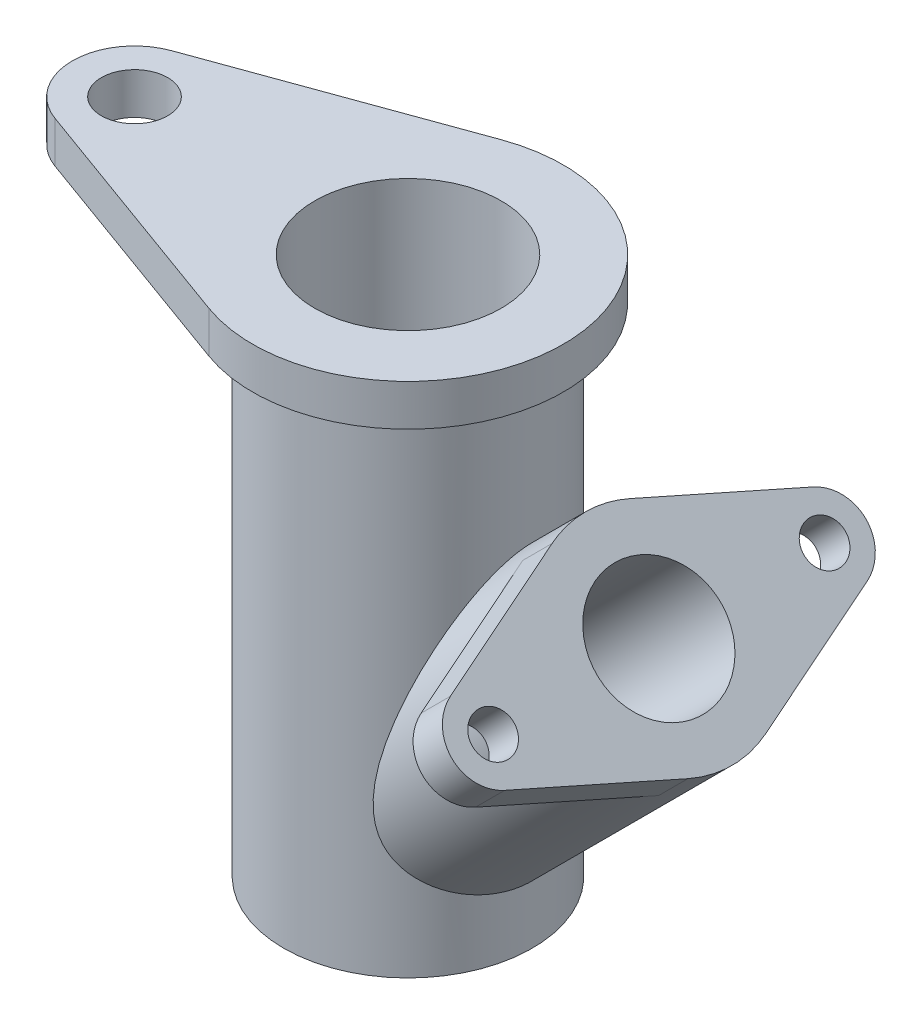
from build123d import *
from build123d.topology import SkipClean

# Parameters (mm, degrees)
SKETCH_1_R                      = 60
EXTRUDE_1_DEPTH                 = 240
SKETCH_2_R                      = 16
EXTRUDE_2_DEPTH                 = 20
CUT_EXTRUDE_1_DEPTH             = 316.38706378
CUT_EXTRUDE_1_DEPTH_BACK        = 316.38706378
SKETCH_6_R                      = 45
EXTRUDE_3_REACH                 = 335.721
EXTRUDE_3_END_RADIUS            = 60
SKETCH_5_R                      = 50
SKETCH_5_R_2                    = 30
CUT_EXTRUDE_2_REACH             = 343.929
SKETCH_8_R                      = 30
CUT_EXTRUDE_2_DIRECTION_2_DEPTH = 342.928852652
SKETCH_9_R                      = 10
SKETCH_9_R_2                    = 30
EXTRUDE_4_DEPTH                 = 20


with BuildPart() as part:
    # 草图1 → 凸台-拉伸1 (new body)
    with BuildSketch(Plane(origin=(0, 0, 0), x_dir=(1, 0, 0), z_dir=(0, 1, 0))):
        with Locations(Location((0, 0, 0), (0, 0, 270))):
            Circle(SKETCH_1_R)
    extrude(amount=EXTRUDE_1_DEPTH)

    # 草图2 → 凸台-拉伸2 (add)
    with BuildSketch(Plane(origin=(0, 240, 0), x_dir=(1, 0, 0), z_dir=(0, 1, 0))):
        with BuildLine():
            Line((-142.227272727, 28.202888018), (-25.568181818, 70.507220045))
            ThreePointArc((-25.568181818, 70.507220045), (75, 0), (-25.568181818, -70.507220045))
            Line((-25.568181818, -70.507220045), (-142.227272727, -28.202888018))
            ThreePointArc((-142.227272727, -28.202888018), (-162, 0), (-142.227272727, 28.202888018))
        make_face()
        with Locations(Location((-132, 0, 0), (0, 0, 270))):
            Circle(SKETCH_2_R, mode=Mode.SUBTRACT)
    extrude(amount=EXTRUDE_2_DEPTH)

    # 草图6 → 切除-拉伸1 (cut, two sides: drawn at the far end of the back side and taken through both)
    with BuildSketch(Plane(origin=(0, 260, 0), x_dir=(1, 0, 0), z_dir=(0, 1, 0)).offset(-CUT_EXTRUDE_1_DEPTH_BACK)):
        with Locations(Location((0, 0, 0), (0, 0, 270))):
            Circle(SKETCH_6_R)
    extrude(amount=CUT_EXTRUDE_1_DEPTH + CUT_EXTRUDE_1_DEPTH_BACK, mode=Mode.SUBTRACT)

    # 凸台-拉伸3: up to this cylinder (the profile starts outside it)
    extrude_3_end = Plane(origin=(0, 125.644661, 0), z_dir=(0, -1, 0)) * Cylinder(EXTRUDE_3_END_RADIUS, 792.442, mode=Mode.PRIVATE)
    # 草图5 → 凸台-拉伸3 (add, up to the surface)
    with BuildSketch(Plane(origin=(121.098951134, 160, 0), x_dir=(0.7071067811865488, -0.7071067811865464, 0), z_dir=(0.7071067811865464, 0.7071067811865488, 0)), mode=Mode.PRIVATE) as extrude_3_sk1:
        with Locations(Location((0, 0, 0), (0, 0, 180))):
            Circle(SKETCH_5_R)
        with Locations(Location((0, 0, 0), (0, 0, 180))):
            Circle(SKETCH_5_R_2, mode=Mode.SUBTRACT)
    extrude_3_tool1 = extrude(extrude_3_sk1.sketch, amount=-EXTRUDE_3_REACH, mode=Mode.PRIVATE) - extrude_3_end
    add(extrude_3_tool1.solids().sort_by_distance((155.45429, 125.644661, 0))[0])

    # 草图8 → 切除-拉伸2 (cut, up to next)
    with BuildSketch(Plane(origin=(140.549475567, 140.549475567, 0), x_dir=(0, 0, -1), z_dir=(0.7071067811865465, 0.7071067811865487, 0)), mode=Mode.PRIVATE) as cut_extrude_2_sk1:
        with Locations(Location((0, 27.507195448, 0), (0, 0, 90))):
            Circle(SKETCH_8_R)
    cut_extrude_2_tool1 = extrude(cut_extrude_2_sk1.sketch, amount=-CUT_EXTRUDE_2_REACH, mode=Mode.PRIVATE) & part.part
    add(cut_extrude_2_tool1.solids().sort_by_distance((121.098951, 160, 0))[0], mode=Mode.SUBTRACT)

    # 草图8 → 切除-拉伸2 direction 2 (cut)
    with BuildSketch(Plane(origin=(140.549475567, 140.549475567, 0), x_dir=(0, 0, -1), z_dir=(0.7071067811865465, 0.7071067811865487, 0))):
        with Locations(Location((0, 27.507195448, 0), (0, 0, 90))):
            Circle(SKETCH_8_R)
    extrude(amount=CUT_EXTRUDE_2_DIRECTION_2_DEPTH, mode=Mode.SUBTRACT)

    # 草图9 → 凸台-拉伸4 (add)
    with SkipClean():  # the faces are left unmerged after this step: merging them gives an invalid solid
        with BuildSketch(Plane(origin=(140.549475567, 140.549475567, 0), x_dir=(0, 0, -1), z_dir=(0.7071067811865465, 0.7071067811865487, 0))):
            with BuildLine():
                Line((-87.5, 46.047691666), (-18.75, 73.858435993))
                ThreePointArc((-18.75, 73.858435993), (0, 77.507195448), (18.75, 73.858435993))
                Line((18.75, 73.858435993), (87.5, 46.047691666))
                ThreePointArc((87.5, 46.047691666), (100, 27.507195448), (87.5, 8.966699231))
                Line((87.5, 8.966699231), (18.75, -18.844045096))
                ThreePointArc((18.75, -18.844045096), (0, -22.492804552), (-18.75, -18.844045096))
                Line((-18.75, -18.844045096), (-87.5, 8.966699231))
                ThreePointArc((-87.5, 8.966699231), (-100, 27.507195448), (-87.5, 46.047691666))
            make_face()
            with Locations(Location((-80, 27.507195448, 0), (0, 0, 90))):
                Circle(SKETCH_9_R, mode=Mode.SUBTRACT)
            with Locations(Location((80, 27.507195448, 0), (0, 0, 90))):
                Circle(SKETCH_9_R, mode=Mode.SUBTRACT)
            with Locations(Location((0, 27.507195448, 0), (0, 0, 90))):
                Circle(SKETCH_9_R_2, mode=Mode.SUBTRACT)
        extrude(amount=-EXTRUDE_4_DEPTH)


solid = part.part
